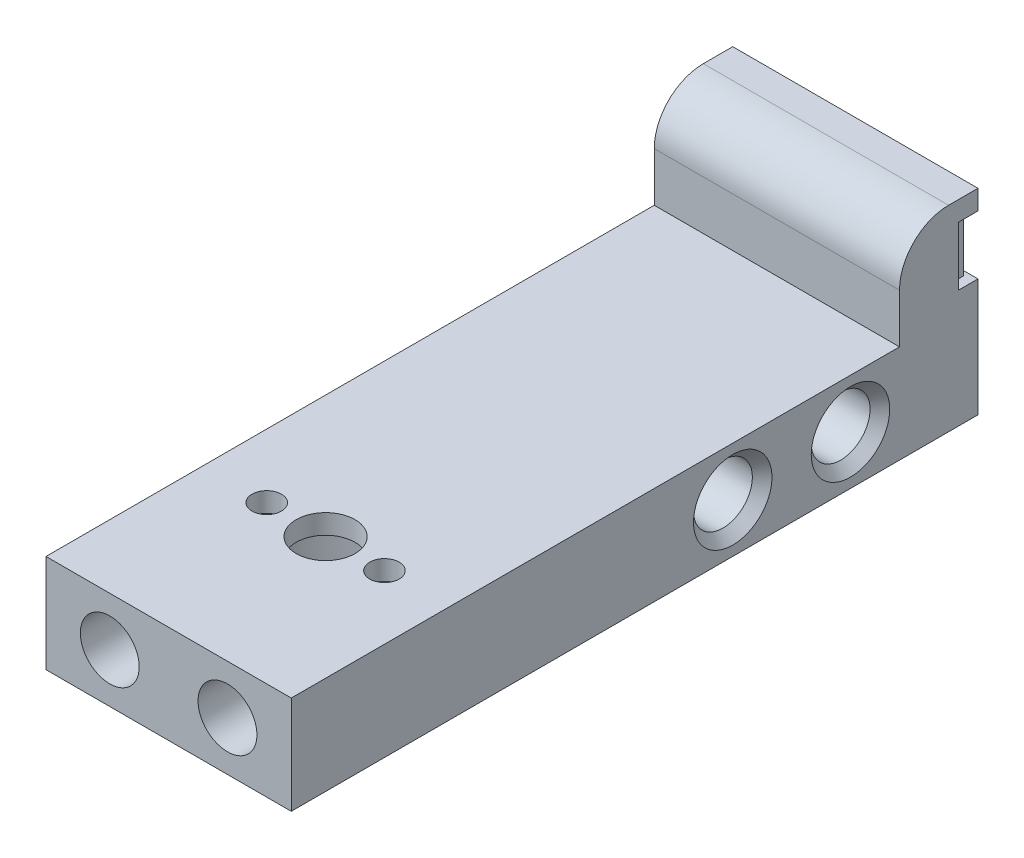
from build123d import *

# Parameters (mm, degrees)
SKETCH1_W                = 25
SKETCH1_H                = 22
BOSS_EXTRUDE1_DEPTH      = 10
SKETCH2_R                = 3
CUT_EXTRUDE1_DEPTH       = 30.086079144
CHAMFER1_SIZE            = 1
BOSS_EXTRUDE4_DEPTH      = 10
BOSS_EXTRUDE4_DEPTH_BACK = 10
SKETCH3_W                = 25
SKETCH3_H                = 8
CUT_EXTRUDE6_DEPTH       = 6
SKETCH5_W                = 25
SKETCH5_H                = 10
BOSS_EXTRUDE3_DEPTH      = 40
SKETCH6_R                = 11
CUT_EXTRUDE3_DEPTH       = 8
SKETCH7_R                = 3
SKETCH7_R_2              = 1.5
CUT_EXTRUDE4_DEPTH       = 8
SKETCH8_R                = 3
CUT_EXTRUDE5_DEPTH       = 5
FILLET1_R                = 5


with BuildPart() as part:
    # Sketch1 → Boss-Extrude1 (new body)
    with BuildSketch(Plane(origin=(0, 0, 0), x_dir=(1, 0, 0), z_dir=(0, 1, 0))):
        Rectangle(SKETCH1_W, SKETCH1_H)
    extrude(amount=BOSS_EXTRUDE1_DEPTH)

    # Sketch2 → Cut-Extrude1 (cut, through all)
    with BuildSketch(Plane(origin=(12.5, 0, 0), x_dir=(0, 0, -1), z_dir=(1, 0, 0))):
        with Locations((-6, 5)):
            Circle(SKETCH2_R)
        with Locations((6, 5)):
            Circle(SKETCH2_R)
    extrude(amount=-CUT_EXTRUDE1_DEPTH, mode=Mode.SUBTRACT)

    # Chamfer1
    chamfer1_edges = [part.edges().sort_by_distance(p)[0] for p in [
        (-12.5, 5, -3),
        (-12.5, 5, 9),
        (12.5, 5, -3),
        (12.5, 5, 9),
    ]]
    chamfer(chamfer1_edges, length=CHAMFER1_SIZE)

    # Sketch3 → Boss-Extrude4 (add, two sides: drawn at the far end of the back side and taken through both)
    with BuildSketch(Plane(origin=(0, 10, 0), x_dir=(1, 0, 0), z_dir=(0, 1, 0)).offset(-BOSS_EXTRUDE4_DEPTH_BACK)):
        with Locations((0, 15)):
            Rectangle(SKETCH3_W, SKETCH3_H)
    extrude(amount=BOSS_EXTRUDE4_DEPTH + BOSS_EXTRUDE4_DEPTH_BACK)

    # Sketch10 → Cut-Extrude6 (cut)
    with BuildSketch(Plane(origin=(0, 18, 0), x_dir=(1, 0, 0), z_dir=(0, 1, 0))):
        Polygon((12.5, 19), (-12.5, 19), (-12.5, 17), (-11.5, 17), (-11.5, 18.5), (-10.5, 18.5), (-10.5, 17), (-9.5, 17), (-9.5, 18.5), (-8.5, 18.5), (-8.5, 17), (-7.5, 17), (-7.5, 18.5), (-6.5, 18.5), (-6.5, 17), (-5.5, 17), (-5.5, 18.5), (-4.5, 18.5), (-4.5, 17), (-3.5, 17), (-3.5, 18.5), (-2.5, 18.5), (-2.5, 17), (-1.5, 17), (-1.5, 18.5), (-0.5, 18.5), (-0.5, 17), (0.5, 17), (0.5, 18.5), (1.5, 18.5), (1.5, 17), (2.5, 17), (2.5, 18.5), (3.5, 18.5), (3.5, 17), (4.5, 17), (4.5, 18.5), (5.5, 18.5), (5.5, 17), (6.5, 17), (6.5, 18.5), (7.5, 18.5), (7.5, 17), (8.5, 17), (8.5, 18.5), (9.5, 18.5), (9.5, 17), (10.5, 17), (10.5, 18.5), (11.5, 18.5), (11.5, 17), (12.5, 17), align=None)
    extrude(amount=-CUT_EXTRUDE6_DEPTH, mode=Mode.SUBTRACT)

    # Sketch5 → Boss-Extrude3 (add)
    with BuildSketch(Plane.XY.offset(11)):
        with Locations((0, 5)):
            Rectangle(SKETCH5_W, SKETCH5_H)
    extrude(amount=BOSS_EXTRUDE3_DEPTH)

    # Sketch6 → Cut-Extrude3 (cut)
    with BuildSketch(Plane.XZ):
        with Locations((0, 35)):
            Circle(SKETCH6_R)
    extrude(amount=-CUT_EXTRUDE3_DEPTH, mode=Mode.SUBTRACT)

    # Sketch7 → Cut-Extrude4 (cut)
    with BuildSketch(Plane.XZ.offset(-8)):
        with Locations((0, 35)):
            Circle(SKETCH7_R)
        with Locations((-6, 35)):
            Circle(SKETCH7_R_2)
        with Locations((6, 35)):
            Circle(SKETCH7_R_2)
    extrude(amount=-CUT_EXTRUDE4_DEPTH, mode=Mode.SUBTRACT)

    # Sketch8 → Cut-Extrude5 (cut)
    with BuildSketch(Plane.XY.offset(51)):
        with Locations((6, 5)):
            Circle(SKETCH8_R)
        with Locations((-6, 5)):
            Circle(SKETCH8_R)
    extrude(amount=-CUT_EXTRUDE5_DEPTH, mode=Mode.SUBTRACT)

    # Fillet1
    fillet1_edges = [part.edges().sort_by_distance(p)[0] for p in [
        (0, 20, -11),
    ]]
    fillet(fillet1_edges, radius=FILLET1_R)


solid = part.part
